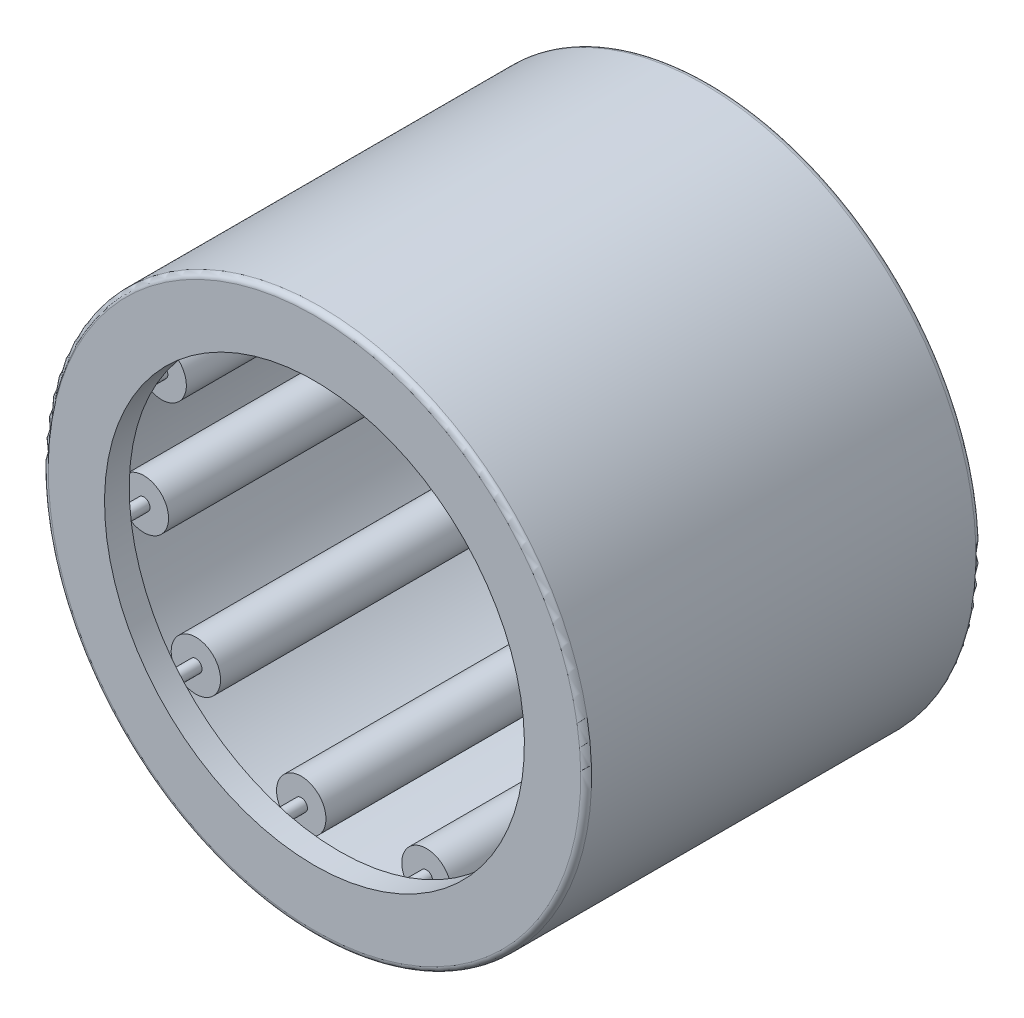
from build123d import *

# Parameters (mm, degrees)
SKETCH2_W         = 9.525
SKETCH2_H         = 0.5953125
SKETCH3_W         = 11.1125
SKETCH3_H         = 0.1984375
CIRPATTERN1_COUNT = 11
CIRPATTERN1_ANGLE = 327.272727273
FILLET1_R         = 0.174625


with BuildPart() as part:
    # Sketch1 → Revolve1 (revolve)
    with BuildSketch(Plane(origin=(0, 0, 0), x_dir=(0, 0, -1), z_dir=(1, 0, 0)), mode=Mode.PRIVATE) as revolve1_sk:
        Polygon((-6.35, 8.73125), (6.35, 8.73125), (6.35, 6.746875), (5.55625, 6.746875), (5.55625, 7.9375), (-5.55625, 7.9375), (-5.55625, 6.746875), (-6.35, 6.746875), align=None)
    revolve(revolve1_sk.sketch.rotate(Axis((0, 0, 6.35), (0, 0, -1)), 180), axis=Axis((0, 0, 6.35), (0, 0, -1)))

    # Fillet1
    fillet1_edges = [part.edges().sort_by_distance(p)[0] for p in [
        (0, 8.73125, 6.35),
        (0, 8.73125, -6.35),
    ]]
    fillet(fillet1_edges, radius=FILLET1_R)


with BuildPart() as body_2:
    # Sketch2 → Revolve2 (revolve)
    with BuildSketch(Plane(origin=(0, 0, 0), x_dir=(0, 0, -1), z_dir=(1, 0, 0)), mode=Mode.PRIVATE) as revolve2_sk:
        with Locations((0, 7.63984375)):
            Rectangle(SKETCH2_W, SKETCH2_H)
    revolve(revolve2_sk.sketch.rotate(Axis((0, 7.14375, 4.7625), (0, 0, -1)), 90), axis=Axis((0, 7.14375, 4.7625), (0, 0, -1)))


with BuildPart() as body_3:
    # Sketch3 → Revolve3 (revolve)
    with BuildSketch(Plane(origin=(0, 0, 0), x_dir=(0, 0, -1), z_dir=(1, 0, 0))):
        with Locations((0, 7.24296875)):
            Rectangle(SKETCH3_W, SKETCH3_H)
    revolve(axis=Axis((0, 7.14375, 5.55625), (0, 0, -1)))


with BuildPart() as cirpattern1_1:
    # CirPattern1: pattern copy
    add(body_2.part.rotate(Axis((0, 0, -6.35), (0, 0, 1)), 1 * CIRPATTERN1_ANGLE / (CIRPATTERN1_COUNT - 1)))


with BuildPart() as cirpattern1_2:
    # CirPattern1: pattern copy
    add(body_2.part.rotate(Axis((0, 0, -6.35), (0, 0, 1)), 2 * CIRPATTERN1_ANGLE / (CIRPATTERN1_COUNT - 1)))


with BuildPart() as cirpattern1_3:
    # CirPattern1: pattern copy
    add(body_2.part.rotate(Axis((0, 0, -6.35), (0, 0, 1)), 3 * CIRPATTERN1_ANGLE / (CIRPATTERN1_COUNT - 1)))


with BuildPart() as cirpattern1_4:
    # CirPattern1: pattern copy
    add(body_2.part.rotate(Axis((0, 0, -6.35), (0, 0, 1)), 4 * CIRPATTERN1_ANGLE / (CIRPATTERN1_COUNT - 1)))


with BuildPart() as cirpattern1_5:
    # CirPattern1: pattern copy
    add(body_2.part.rotate(Axis((0, 0, -6.35), (0, 0, 1)), 5 * CIRPATTERN1_ANGLE / (CIRPATTERN1_COUNT - 1)))


with BuildPart() as cirpattern1_6:
    # CirPattern1: pattern copy
    add(body_2.part.rotate(Axis((0, 0, -6.35), (0, 0, 1)), 6 * CIRPATTERN1_ANGLE / (CIRPATTERN1_COUNT - 1)))


with BuildPart() as cirpattern1_7:
    # CirPattern1: pattern copy
    add(body_2.part.rotate(Axis((0, 0, -6.35), (0, 0, 1)), 7 * CIRPATTERN1_ANGLE / (CIRPATTERN1_COUNT - 1)))


with BuildPart() as cirpattern1_8:
    # CirPattern1: pattern copy
    add(body_2.part.rotate(Axis((0, 0, -6.35), (0, 0, 1)), 8 * CIRPATTERN1_ANGLE / (CIRPATTERN1_COUNT - 1)))


with BuildPart() as cirpattern1_9:
    # CirPattern1: pattern copy
    add(body_2.part.rotate(Axis((0, 0, -6.35), (0, 0, 1)), 9 * CIRPATTERN1_ANGLE / (CIRPATTERN1_COUNT - 1)))


with BuildPart() as cirpattern1_10:
    # CirPattern1: pattern copy
    add(body_2.part.rotate(Axis((0, 0, -6.35), (0, 0, 1)), 10 * CIRPATTERN1_ANGLE / (CIRPATTERN1_COUNT - 1)))


with BuildPart() as cirpattern1_11:
    # CirPattern1: pattern copy
    add(body_3.part.rotate(Axis((0, 0, -6.35), (0, 0, 1)), 1 * CIRPATTERN1_ANGLE / (CIRPATTERN1_COUNT - 1)))


with BuildPart() as cirpattern1_12:
    # CirPattern1: pattern copy
    add(body_3.part.rotate(Axis((0, 0, -6.35), (0, 0, 1)), 2 * CIRPATTERN1_ANGLE / (CIRPATTERN1_COUNT - 1)))


with BuildPart() as cirpattern1_13:
    # CirPattern1: pattern copy
    add(body_3.part.rotate(Axis((0, 0, -6.35), (0, 0, 1)), 3 * CIRPATTERN1_ANGLE / (CIRPATTERN1_COUNT - 1)))


with BuildPart() as cirpattern1_14:
    # CirPattern1: pattern copy
    add(body_3.part.rotate(Axis((0, 0, -6.35), (0, 0, 1)), 4 * CIRPATTERN1_ANGLE / (CIRPATTERN1_COUNT - 1)))


with BuildPart() as cirpattern1_15:
    # CirPattern1: pattern copy
    add(body_3.part.rotate(Axis((0, 0, -6.35), (0, 0, 1)), 5 * CIRPATTERN1_ANGLE / (CIRPATTERN1_COUNT - 1)))


with BuildPart() as cirpattern1_16:
    # CirPattern1: pattern copy
    add(body_3.part.rotate(Axis((0, 0, -6.35), (0, 0, 1)), 6 * CIRPATTERN1_ANGLE / (CIRPATTERN1_COUNT - 1)))


with BuildPart() as cirpattern1_17:
    # CirPattern1: pattern copy
    add(body_3.part.rotate(Axis((0, 0, -6.35), (0, 0, 1)), 7 * CIRPATTERN1_ANGLE / (CIRPATTERN1_COUNT - 1)))


with BuildPart() as cirpattern1_18:
    # CirPattern1: pattern copy
    add(body_3.part.rotate(Axis((0, 0, -6.35), (0, 0, 1)), 8 * CIRPATTERN1_ANGLE / (CIRPATTERN1_COUNT - 1)))


with BuildPart() as cirpattern1_19:
    # CirPattern1: pattern copy
    add(body_3.part.rotate(Axis((0, 0, -6.35), (0, 0, 1)), 9 * CIRPATTERN1_ANGLE / (CIRPATTERN1_COUNT - 1)))


with BuildPart() as cirpattern1_20:
    # CirPattern1: pattern copy
    add(body_3.part.rotate(Axis((0, 0, -6.35), (0, 0, 1)), 10 * CIRPATTERN1_ANGLE / (CIRPATTERN1_COUNT - 1)))


solid = Compound([part.part, body_2.part, body_3.part, cirpattern1_1.part, cirpattern1_2.part, cirpattern1_3.part, cirpattern1_4.part, cirpattern1_5.part, cirpattern1_6.part, cirpattern1_7.part, cirpattern1_8.part, cirpattern1_9.part, cirpattern1_10.part, cirpattern1_11.part, cirpattern1_12.part, cirpattern1_13.part, cirpattern1_14.part, cirpattern1_15.part, cirpattern1_16.part, cirpattern1_17.part, cirpattern1_18.part, cirpattern1_19.part, cirpattern1_20.part])
